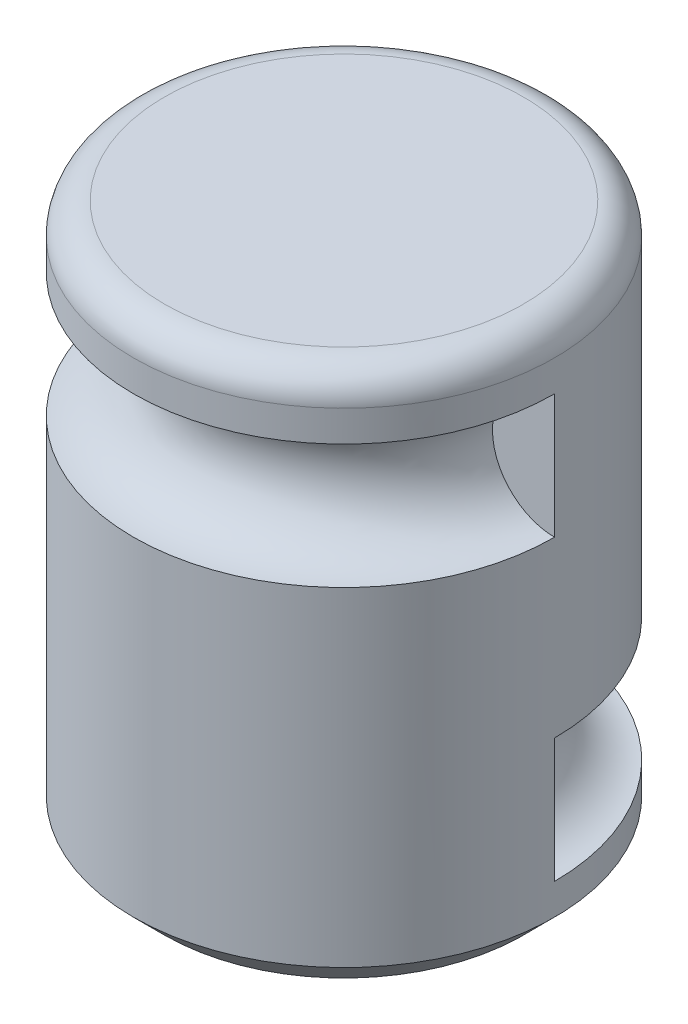
from build123d import *

# Parameters (mm, degrees)
SKETCH1_R           = 33.905425059
BOSS_EXTRUDE1_DEPTH = 88
SKETCH2_R           = 10
CUT_REVOLVE1_ANGLE  = 180
FILLET1_R           = 5
CHAMFER1_SIZE       = 5


with BuildPart() as part:
    # Sketch1 → Boss-Extrude1 (new body)
    with BuildSketch(Plane(origin=(0, 0, 0), x_dir=(1, 0, 0), z_dir=(0, 1, 0))):
        with Locations(Location((0, 0, 0), (0, 0, 270))):
            Circle(SKETCH1_R)
    extrude(amount=BOSS_EXTRUDE1_DEPTH)

    # Sketch2 → Cut-Revolve1 (revolve, cut)
    with BuildSketch(Plane.XY):
        with Locations((33.905425059, 68)):
            Circle(SKETCH2_R)
        with Locations((-33.905425059, 20)):
            Circle(SKETCH2_R)
    revolve(axis=Axis((0, 39.08266512, 0), (0, -1, 0)), revolution_arc=CUT_REVOLVE1_ANGLE, mode=Mode.SUBTRACT)

    # Fillet1
    fillet1_edges = [part.edges().sort_by_distance(p)[0] for p in [
        (0, 88, -33.905425059),
    ]]
    fillet(fillet1_edges, radius=FILLET1_R)

    # Chamfer1
    chamfer1_edges = [part.edges().sort_by_distance(p)[0] for p in [
        (0, 0, -33.905425059),
    ]]
    chamfer(chamfer1_edges, length=CHAMFER1_SIZE)


solid = part.part
